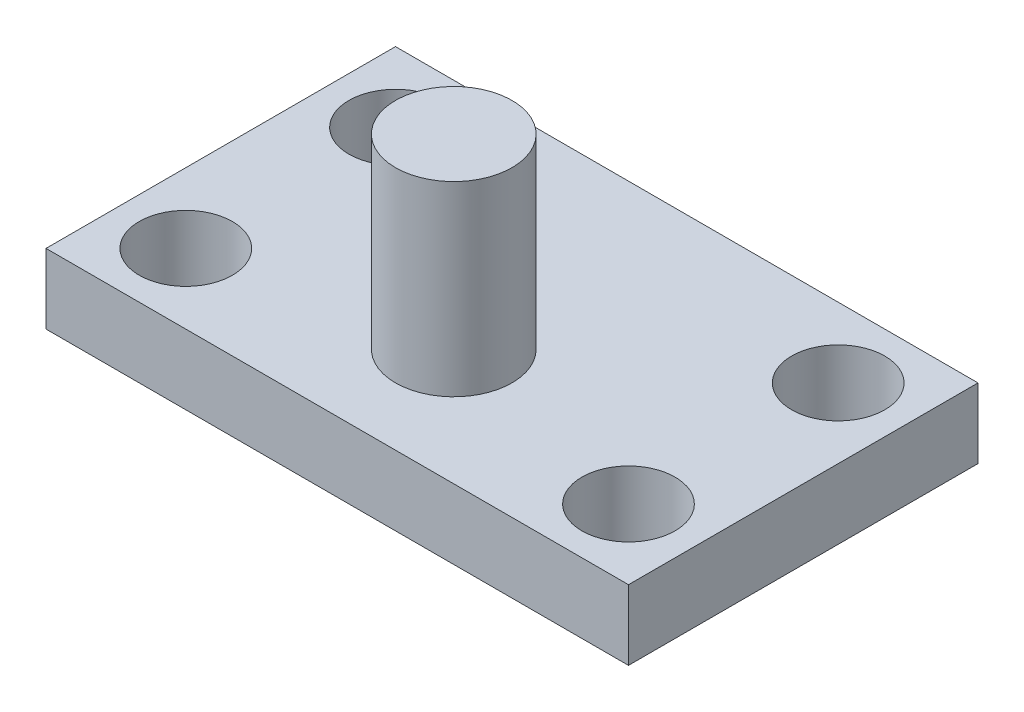
from build123d import *

# Parameters (mm, degrees)
SKETCH1_W           = 250
SKETCH1_H           = 150
SKETCH1_R           = 20
BOSS_EXTRUDE1_DEPTH = 30
SKETCH2_R           = 25
BOSS_EXTRUDE2_DEPTH = 80


with BuildPart() as part:
    # Sketch1 → Boss-Extrude1 (new body)
    with BuildSketch(Plane(origin=(0, 0, 0), x_dir=(1, 0, 0), z_dir=(0, 1, 0))):
        Rectangle(SKETCH1_W, SKETCH1_H)
        with Locations(Location((-95, 45, 0), (0, 0, 270))):
            Circle(SKETCH1_R, mode=Mode.SUBTRACT)
        with Locations(Location((-95, -45, 0), (0, 0, 90))):
            Circle(SKETCH1_R, mode=Mode.SUBTRACT)
        with Locations(Location((95, -45, 0), (0, 0, 270))):
            Circle(SKETCH1_R, mode=Mode.SUBTRACT)
        with Locations(Location((95, 45, 0), (0, 0, 90))):
            Circle(SKETCH1_R, mode=Mode.SUBTRACT)
    extrude(amount=BOSS_EXTRUDE1_DEPTH)

    # Sketch2 → Boss-Extrude2 (add)
    with BuildSketch(Plane(origin=(0, 30, 0), x_dir=(1, 0, 0), z_dir=(0, 1, 0))):
        with Locations(Location((0, -25, 0), (0, 0, 270))):
            Circle(SKETCH2_R)
    extrude(amount=BOSS_EXTRUDE2_DEPTH)


solid = part.part
